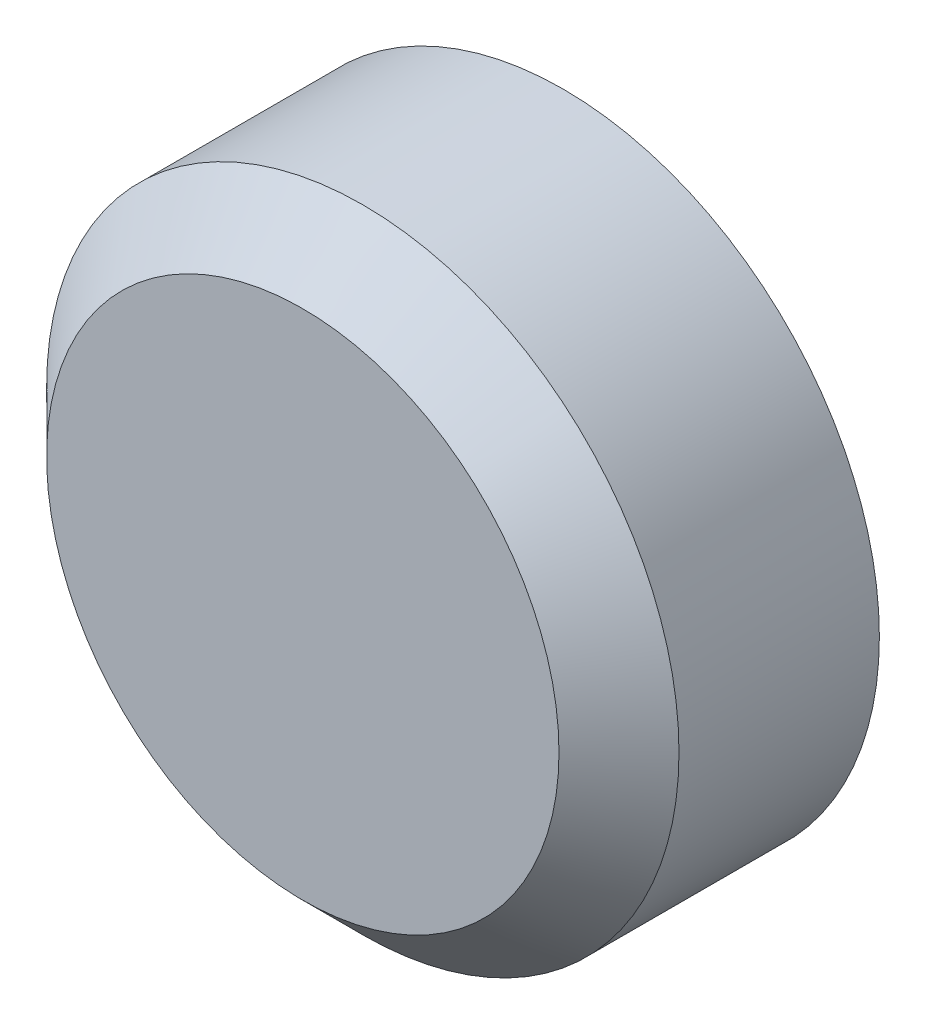
from build123d import *

# Parameters (mm, degrees)
ESQUISSE1_R        = 2.635
BOSS_EXTRU_1_DEPTH = 2.17
CHANFREIN1_SIZE    = 0.5


with BuildPart() as part:
    # Esquisse1 → Boss.-Extru.1 (new body)
    with BuildSketch(Plane.XY):
        Circle(ESQUISSE1_R)
    extrude(amount=BOSS_EXTRU_1_DEPTH)

    # Chanfrein1
    chanfrein1_edges = [part.edges().sort_by_distance(p)[0] for p in [
        (-2.635, 0, 2.17),
    ]]
    chamfer(chanfrein1_edges, length=CHANFREIN1_SIZE)


solid = part.part
